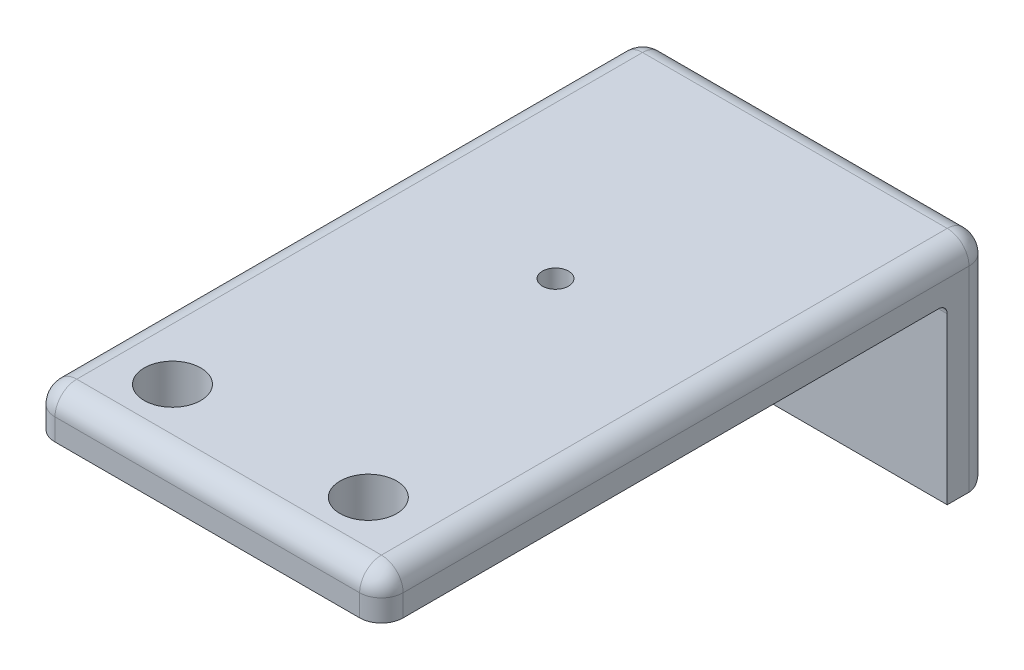
from build123d import *

# Parameters (mm, degrees)
BOSS_EXTRUDE1_DEPTH = 80
SKETCH2_R           = 6.5
CUT_EXTRUDE1_DEPTH  = 167.132477258
SKETCH3_R           = 33
CUT_EXTRUDE2_DEPTH  = 5
FILLET1_R           = 2
SKETCH4_R           = 6.5
CUT_EXTRUDE3_DEPTH  = 158.797338381
FILLET2_R           = 5
FILLET3_R           = 2
SKETCH5_R           = 3
CUT_EXTRUDE4_DEPTH  = 168.406690428


with BuildPart() as part:
    # Sketch1 → Boss-Extrude1 (new body)
    with BuildSketch(Plane(origin=(0, 0, 0), x_dir=(0, 0, -1), z_dir=(1, 0, 0))):
        Polygon((0, 0), (130, 0), (130, -40), (140, -40), (140, 10), (0, 10), align=None)
    extrude(amount=BOSS_EXTRUDE1_DEPTH)

    # Sketch2 → Cut-Extrude1 (cut, through all)
    with BuildSketch(Plane.XZ):
        with Locations(Location((17, -15, 0), (0, 0, 270))):
            Circle(SKETCH2_R)
        with Locations(Location((62, -15, 0), (0, 0, 270))):
            Circle(SKETCH2_R)
    extrude(amount=-CUT_EXTRUDE1_DEPTH, mode=Mode.SUBTRACT)

    # Sketch3 → Cut-Extrude2 (cut)
    with BuildSketch(Plane.XZ):
        with Locations(Location((40, -80, 0), (0, 0, 270))):
            Circle(SKETCH3_R)
    extrude(amount=-CUT_EXTRUDE2_DEPTH, mode=Mode.SUBTRACT)

    # Fillet1
    fillet1_edges = [part.edges().sort_by_distance(p)[0] for p in [
        (40, 5, -47),
        (40, 0, -47),
    ]]
    fillet(fillet1_edges, radius=FILLET1_R)

    # Sketch4 → Cut-Extrude3 (cut, through all)
    with BuildSketch(Plane.XY.offset(-130)):
        with Locations((40, -28)):
            Circle(SKETCH4_R)
    extrude(amount=-CUT_EXTRUDE3_DEPTH, mode=Mode.SUBTRACT)

    # Fillet2
    fillet2_edges = [part.edges().sort_by_distance(p)[0] for p in [
        (40, 10, 0),
        (40, 10, -140),
        (40, -40, -140),
        (80, -15, -140),
        (80, 10, -70),
        (80, 5, 0),
        (0, 10, -70),
        (0, -15, -140),
        (0, 5, 0),
    ]]
    fillet(fillet2_edges, radius=FILLET2_R)

    # Fillet3
    fillet3_edges = [part.edges().sort_by_distance(p)[0] for p in [
        (40, 0, -130),
    ]]
    fillet(fillet3_edges, radius=FILLET3_R)

    # Sketch5 → Cut-Extrude4 (cut, through all)
    with BuildSketch(Plane.XZ.offset(-5)):
        with Locations(Location((40, -80, 0), (0, 0, 270))):
            Circle(SKETCH5_R)
    extrude(amount=-CUT_EXTRUDE4_DEPTH, mode=Mode.SUBTRACT)


solid = part.part
